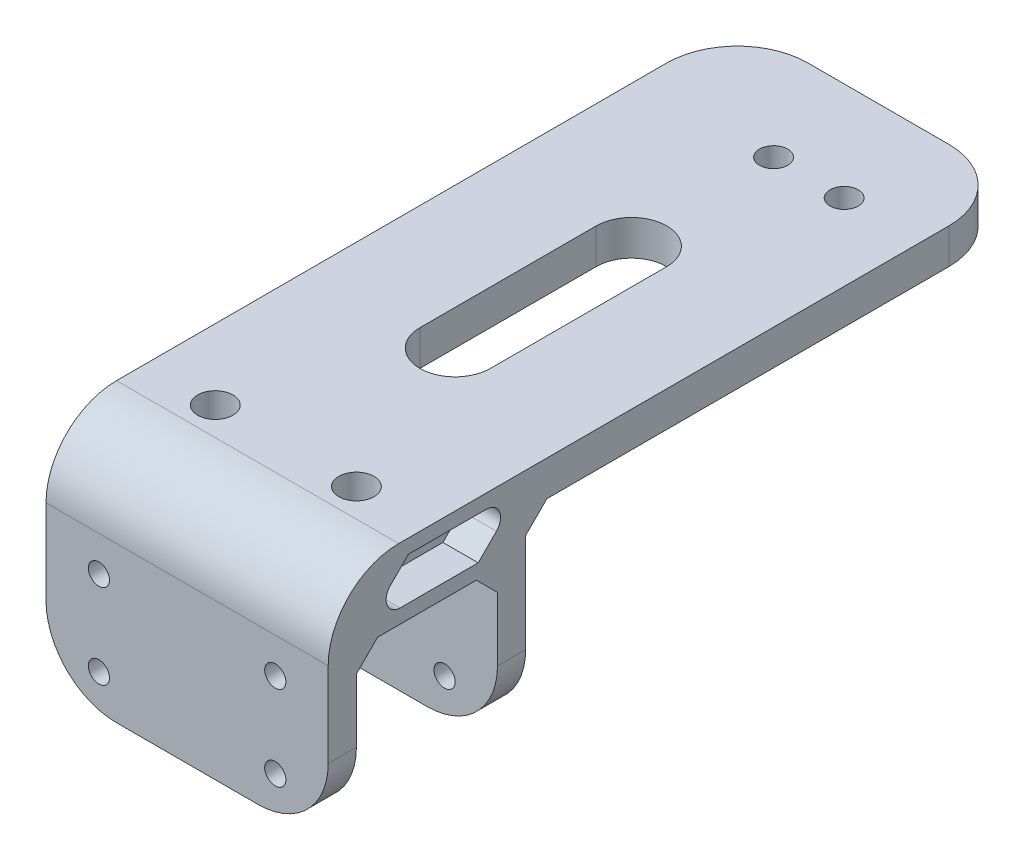
from build123d import *

# Parameters (mm, degrees)
SKETCH_1_W          = 40
SKETCH_1_H          = 28
EXTRUDE_1_DEPTH     = 10
SKETCH_2_W          = 40
SKETCH_2_H          = 4
EXTRUDE_2_DEPTH     = 10
SKETCH_4_W          = 40
SKETCH_4_H          = 5
EXTRUDE_3_DEPTH     = 15
SKETCH_6_W          = 40
SKETCH_6_H          = 5
EXTRUDE_4_DEPTH     = 15
SKETCH_8_R          = 2.5
CUT_EXTRUDE_2_DEPTH = 15
CHAMFER_1_SIZE      = 3
FILLET_1_R          = 10
CHAMFER_2_SIZE      = 3
SKETCH_9_R          = 1.5
CUT_EXTRUDE_3_DEPTH = 38.416573868
CUT_EXTRUDE_4_DEPTH = 5
FILLET_3_R          = 2
SKETCH_11_W         = 40
SKETCH_11_H         = 7
EXTRUDE_5_DEPTH     = 3
CHAMFER_3_SIZE      = 1
SKETCH_12_W         = 40
SKETCH_12_H         = 5
EXTRUDE_6_DEPTH     = 30
SKETCH_13_R         = 2
CUT_EXTRUDE_5_DEPTH = 30
SKETCH_16_W         = 20
SKETCH_16_H         = 6.386072782
CUT_EXTRUDE_6_DEPTH = 85.711274338
SKETCH_17_W         = 40
SKETCH_17_H         = 4
EXTRUDE_8_DEPTH     = 12
SKETCH_18_R         = 1.5
CUT_EXTRUDE_7_DEPTH = 93.887028158
CUT_EXTRUDE_8_DEPTH = 84.066238629
SKETCH_21_W         = 40
SKETCH_21_H         = 5
EXTRUDE_9_DEPTH     = 10
FILLET_5_R          = 10


with BuildPart() as part:
    # 草图1 → 凸台-拉伸1 (new body)
    with BuildSketch(Plane(origin=(0, 0, 0), x_dir=(1, 0, 0), z_dir=(0, 1, 0))):
        Rectangle(SKETCH_1_W, SKETCH_1_H)
    extrude(amount=EXTRUDE_1_DEPTH)

    # 草图2 → 凸台-拉伸2 (add)
    with BuildSketch(Plane.XZ):
        with Locations((0, 12)):
            Rectangle(SKETCH_2_W, SKETCH_2_H)
        with Locations((0, -12)):
            Rectangle(SKETCH_2_W, SKETCH_2_H)
    extrude(amount=EXTRUDE_2_DEPTH)

    # 草图4 → 凸台-拉伸3 (add)
    with BuildSketch(Plane(origin=(0, 0, -14), x_dir=(-1, 0, 0), z_dir=(0, 0, -1))):
        with Locations((0, 7.5)):
            Rectangle(SKETCH_4_W, SKETCH_4_H)
    extrude(amount=EXTRUDE_3_DEPTH)

    # 草图6 → 凸台-拉伸4 (add)
    with BuildSketch(Plane(origin=(0, 0, -29), x_dir=(-1, 0, 0), z_dir=(0, 0, -1))):
        with Locations((0, 7.5)):
            Rectangle(SKETCH_6_W, SKETCH_6_H)
    extrude(amount=EXTRUDE_4_DEPTH)

    # 草图8 → 切除-拉伸2 (cut)
    with BuildSketch(Plane(origin=(0, 10, 0), x_dir=(1, 0, 0), z_dir=(0, 1, 0))):
        with Locations(Location((-10, 0, 0), (0, 0, 270))):
            Circle(SKETCH_8_R)
        with Locations(Location((10, 0, 0), (0, 0, 270))):
            Circle(SKETCH_8_R)
    extrude(amount=-CUT_EXTRUDE_2_DEPTH, mode=Mode.SUBTRACT)

    # 倒角1
    chamfer_1_edges = [part.edges().sort_by_distance(p)[0] for p in [
        (0, 0, 10),
        (0, 0, -10),
    ]]
    chamfer(chamfer_1_edges, length=CHAMFER_1_SIZE)

    # 圆角1
    fillet_1_edges = [part.edges().sort_by_distance(p)[0] for p in [
        (0, 10, 14),
    ]]
    fillet(fillet_1_edges, radius=FILLET_1_R)

    # 倒角2
    chamfer_2_edges = [part.edges().sort_by_distance(p)[0] for p in [
        (0, 5, -14),
    ]]
    chamfer(chamfer_2_edges, length=CHAMFER_2_SIZE)

    # 草图9 → 切除-拉伸3 (cut, through all)
    with BuildSketch(Plane(origin=(0, 0, -14), x_dir=(-1, 0, 0), z_dir=(0, 0, -1))):
        with Locations((-12.5, -5)):
            Circle(SKETCH_9_R)
        with Locations((12.5, -5)):
            Circle(SKETCH_9_R)
    extrude(amount=-CUT_EXTRUDE_3_DEPTH, mode=Mode.SUBTRACT)

    # 草图10 → 切除-拉伸4 (cut)
    with BuildSketch(Plane(origin=(20, 0, 0), x_dir=(0, 0, -1), z_dir=(1, 0, 0))):
        Polygon((-2.618541417, 8), (-8.618541417, 2), (7.264071942, 2), (13.264071942, 8), align=None)
    cut_extrude_4 = extrude(amount=-CUT_EXTRUDE_4_DEPTH, mode=Mode.SUBTRACT)

    # 圆角3
    fillet_3_edges = [part.edges().sort_by_distance(p)[0] for p in [
        (17.5, 8, -13.264071942),
        (17.5, 2, 8.618541417),
    ]]
    fillet(fillet_3_edges, radius=FILLET_3_R)

    # 镜向1: 切除-拉伸4 across plane
    add(cut_extrude_4.mirror(Plane(origin=(0, 0, 0), x_dir=(0, 0, 1), z_dir=(1, 0, 0))), mode=Mode.SUBTRACT)

    # 草图11 → 凸台-拉伸5 (add)
    with BuildSketch(Plane.XZ.offset(10)):
        with Locations((0, -10.5)):
            Rectangle(SKETCH_11_W, SKETCH_11_H)
        with Locations((0, 10.5)):
            Rectangle(SKETCH_11_W, SKETCH_11_H)
    extrude(amount=-EXTRUDE_5_DEPTH)

    # 倒角3
    chamfer_3_edges = [part.edges().sort_by_distance(p)[0] for p in [
        (0, -7, -7),
        (0, -7, 7),
    ]]
    chamfer(chamfer_3_edges, length=CHAMFER_3_SIZE)

    # 草图12 → 凸台-拉伸6 (add)
    with BuildSketch(Plane(origin=(0, 0, -44), x_dir=(-1, 0, 0), z_dir=(0, 0, -1))):
        with Locations((0, 7.5)):
            Rectangle(SKETCH_12_W, SKETCH_12_H)
    extrude(amount=EXTRUDE_6_DEPTH)

    # 草图13 → 切除-拉伸5 (cut)
    with BuildSketch(Plane(origin=(0, 10, 0), x_dir=(1, 0, 0), z_dir=(0, 1, 0))):
        with Locations(Location((9.14, 70, 0), (0, 0, 270))):
            Circle(SKETCH_13_R)
        with Locations(Location((-0.86, 70, 0), (0, 0, 270))):
            Circle(SKETCH_13_R)
    extrude(amount=-CUT_EXTRUDE_5_DEPTH, mode=Mode.SUBTRACT)

    # 草图16 → 切除-拉伸6 (cut, through all)
    with BuildSketch(Plane(origin=(20, 0, 0), x_dir=(0, 0, -1), z_dir=(1, 0, 0))):
        with Locations((0, -10.193036391)):
            Rectangle(SKETCH_16_W, SKETCH_16_H)
    extrude(amount=-CUT_EXTRUDE_6_DEPTH, mode=Mode.SUBTRACT)

    # 草图17 → 凸台-拉伸8 (add)
    with BuildSketch(Plane.XZ.offset(10)):
        with Locations((0, -12)):
            Rectangle(SKETCH_17_W, SKETCH_17_H)
        with Locations((0, 12)):
            Rectangle(SKETCH_17_W, SKETCH_17_H)
    extrude(amount=EXTRUDE_8_DEPTH)

    # 草图18 → 切除-拉伸7 (cut, through all)
    with BuildSketch(Plane.XY.offset(14)):
        with Locations(Location((12.5, -5, 0), (0, 0, 180))):
            Circle(SKETCH_18_R)
        with Locations(Location((-12.5, -5, 0), (0, 0, 180))):
            Circle(SKETCH_18_R)
        with Locations((-12.5, -17)):
            Circle(SKETCH_18_R)
        with Locations((12.5, -17)):
            Circle(SKETCH_18_R)
    extrude(amount=-CUT_EXTRUDE_7_DEPTH, mode=Mode.SUBTRACT)

    # 草图19 → 切除-拉伸8 (cut, through all)
    with BuildSketch(Plane(origin=(0, 10, 0), x_dir=(1, 0, 0), z_dir=(0, 1, 0))):
        with BuildLine():
            Line((5, 49), (5, 24))
            ThreePointArc((5, 24), (0, 19), (-5, 24))
            Line((-5, 24), (-5, 49))
            ThreePointArc((-5, 49), (0, 54), (5, 49))
        make_face()
    extrude(amount=-CUT_EXTRUDE_8_DEPTH, mode=Mode.SUBTRACT)

    # 草图21 → 凸台-拉伸9 (add)
    with BuildSketch(Plane(origin=(0, 0, -74), x_dir=(-1, 0, 0), z_dir=(0, 0, -1))):
        with Locations((0, 7.5)):
            Rectangle(SKETCH_21_W, SKETCH_21_H)
    extrude(amount=EXTRUDE_9_DEPTH)

    # 圆角5
    fillet_5_edges = [part.edges().sort_by_distance(p)[0] for p in [
        (-20, -22, -12),
        (20, -22, -12),
        (-20, -22, 12),
        (20, -22, 12),
        (20, 7.5, -84),
        (-20, 7.5, -84),
    ]]
    fillet(fillet_5_edges, radius=FILLET_5_R)


solid = part.part
